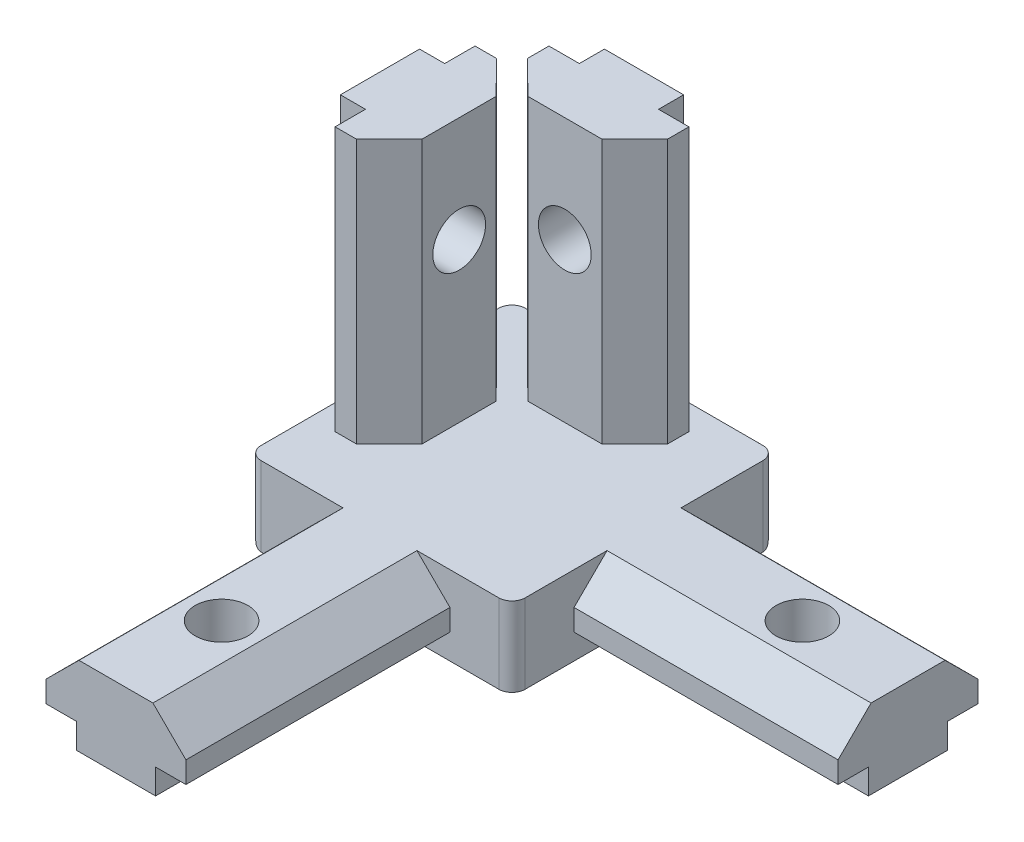
from build123d import *

# Parameters (mm, degrees)
SKETCH1_W           = 20
SKETCH1_H           = 20
BOSS_EXTRUDE1_DEPTH = 6
BOSS_EXTRUDE2_DEPTH = 26
SKETCH5_R           = 2
CUT_EXTRUDE1_DEPTH  = 32.176914536
CIRPATTERN1_COUNT   = 2
CIRPATTERN1_ANGLE   = 90
BOSS_EXTRUDE3_DEPTH = 20
SKETCH6_R           = 2
CUT_EXTRUDE2_DEPTH  = 38.416573868
CIRPATTERN2_COUNT   = 2
CIRPATTERN2_ANGLE   = 90
FILLET1_R           = 1


with BuildPart() as part:
    # Sketch1 → Boss-Extrude1 (new body)
    with BuildSketch(Plane(origin=(0, 0, 0), x_dir=(1, 0, 0), z_dir=(0, 1, 0))):
        Rectangle(SKETCH1_W, SKETCH1_H)
    extrude(amount=BOSS_EXTRUDE1_DEPTH)

    # Sketch2 → Boss-Extrude2 (add)
    with BuildSketch(Plane(origin=(0, 0, 0), x_dir=(1, 0, 0), z_dir=(0, 1, 0))):
        Polygon((-3, 10), (3, 10), (3, 8.1), (5.3, 8.1), (5.3, 6.48), (2.8, 4), (-2.8, 4), (-5.3, 6.48), (-5.3, 8.1), (-3, 8.1), align=None)
    boss_extrude2 = extrude(amount=BOSS_EXTRUDE2_DEPTH)

    # Sketch5 → Cut-Extrude1 (cut, through all)
    with BuildSketch(Plane.XY.offset(-4)):
        with Locations((0, 18)):
            Circle(SKETCH5_R)
    cut_extrude1 = extrude(amount=-CUT_EXTRUDE1_DEPTH, mode=Mode.SUBTRACT)

    # CirPattern1: Boss-Extrude2, Cut-Extrude1 ×2 about axis
    cirpattern1_axis = Axis((0, 0, 0), (0, 1, 0))
    add([boss_extrude2.rotate(cirpattern1_axis, i * CIRPATTERN1_ANGLE / (CIRPATTERN1_COUNT - 1)) for i in range(1, CIRPATTERN1_COUNT)])
    add([cut_extrude1.rotate(cirpattern1_axis, i * CIRPATTERN1_ANGLE / (CIRPATTERN1_COUNT - 1)) for i in range(1, CIRPATTERN1_COUNT)], mode=Mode.SUBTRACT)

    # Sketch4 → Boss-Extrude3 (add)
    with BuildSketch(Plane(origin=(10, 6.045130441, 0.430052004), x_dir=(0, 0, 1), z_dir=(1, 0, 0))):
        Polygon((-3.430052004, 6.045130441), (2.569947996, 6.045130441), (2.569947996, 4.145130441), (4.869947996, 4.145130441), (4.869947996, 2.525130441), (2.369947996, 0.045130441), (-3.230052004, 0.045130441), (-5.730052004, 2.525130441), (-5.730052004, 4.145130441), (-3.430052004, 4.145130441), align=None)
    boss_extrude3 = extrude(amount=BOSS_EXTRUDE3_DEPTH)

    # Sketch6 → Cut-Extrude2 (cut, through all)
    with BuildSketch(Plane(origin=(0, 6, 0), x_dir=(1, 0, 0), z_dir=(0, 1, 0))):
        with Locations(Location((22, 0, 0), (0, 0, 270))):
            Circle(SKETCH6_R)
    cut_extrude2 = extrude(amount=-CUT_EXTRUDE2_DEPTH, mode=Mode.SUBTRACT)

    # CirPattern2: Boss-Extrude3, Cut-Extrude2 ×2 about axis
    cirpattern2_axis = Axis((0, 0, 0), (0, -1, 0))
    add([boss_extrude3.rotate(cirpattern2_axis, i * CIRPATTERN2_ANGLE / (CIRPATTERN2_COUNT - 1)) for i in range(1, CIRPATTERN2_COUNT)])
    add([cut_extrude2.rotate(cirpattern2_axis, i * CIRPATTERN2_ANGLE / (CIRPATTERN2_COUNT - 1)) for i in range(1, CIRPATTERN2_COUNT)], mode=Mode.SUBTRACT)

    # Fillet1
    fillet1_edges = [part.edges().sort_by_distance(p)[0] for p in [
        (-10, 0, 0),
        (0, 0, -10),
        (10, 3, -10),
        (10, 3, 10),
        (-10, 3, 10),
        (-10, 3, -10),
    ]]
    fillet(fillet1_edges, radius=FILLET1_R)


solid = part.part
